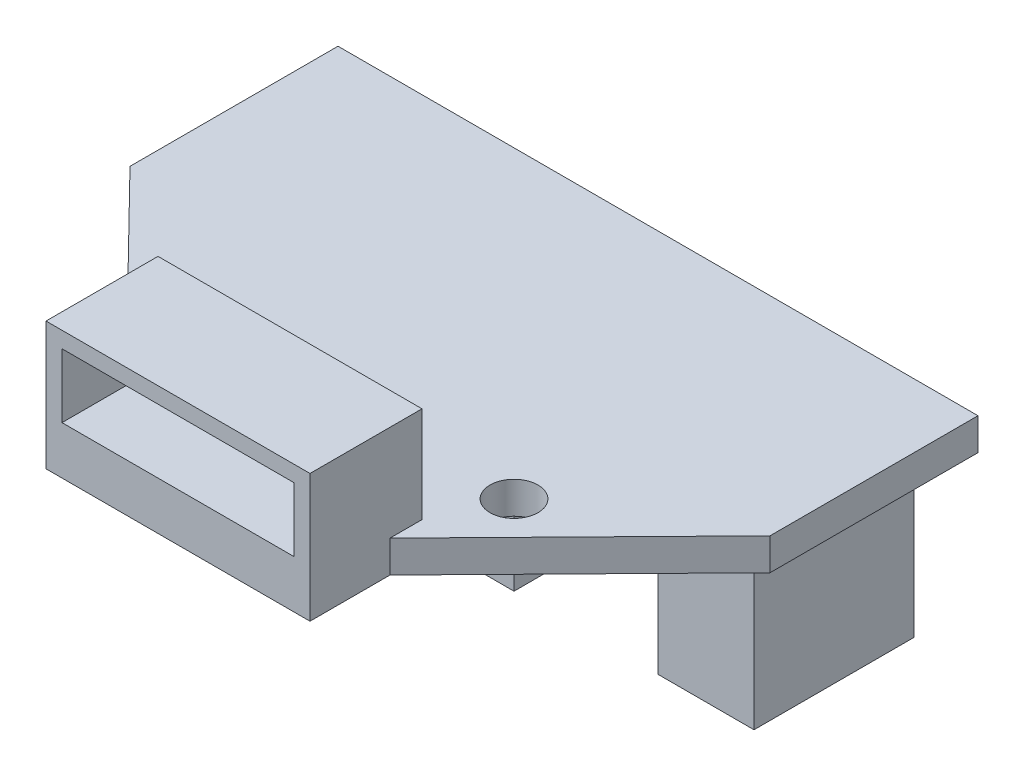
from build123d import *

# Parameters (mm, degrees)
SKETCH_1_R             = 1.5
EXTRUDE_1_DEPTH        = 2
SKETCH_2_W             = 16.5
SKETCH_2_H             = 7
EXTRUDE_2_DEPTH        = 6
SKETCH_3_W             = 6
SKETCH_3_H             = 10
EXTRUDE_3_DEPTH        = 10
PATTERN_LINEAR_1_COUNT = 2
PATTERN_LINEAR_1_PITCH = 15
PATTERN_LINEAR_2_COUNT = 2
PATTERN_LINEAR_2_PITCH = 15
SKETCH_4_W             = 14.5
SKETCH_4_H             = 4
CUT_EXTRUDE_1_DEPTH    = 5


with BuildPart() as part:
    # 草图1 → 凸台-拉伸1 (new body)
    with BuildSketch(Plane(origin=(0, 0, 0), x_dir=(1, 0, 0), z_dir=(0, 1, 0))):
        Polygon((-20, 15), (20, 15), (20, 2), (8.25, -10), (8.25, -15), (-8.25, -15), (-8.25, -10), (-20, 2), align=None)
        with Locations(Location((-10, -4, 0), (0, 0, 270))):
            Circle(SKETCH_1_R, mode=Mode.SUBTRACT)
        with Locations(Location((10, -4, 0), (0, 0, 270))):
            Circle(SKETCH_1_R, mode=Mode.SUBTRACT)
    extrude(amount=EXTRUDE_1_DEPTH)

    # 草图2 → 凸台-拉伸2 (add)
    with BuildSketch(Plane(origin=(0, 2, 0), x_dir=(1, 0, 0), z_dir=(0, 1, 0))):
        with Locations((0, -11.5)):
            Rectangle(SKETCH_2_W, SKETCH_2_H)
    extrude(amount=EXTRUDE_2_DEPTH)

    # 草图3 → 凸台-拉伸3 (add)
    with BuildSketch(Plane.XZ):
        with Locations((0, -8)):
            Rectangle(SKETCH_3_W, SKETCH_3_H)
    extrude_3 = extrude(amount=EXTRUDE_3_DEPTH)

    # 阵列(线性)1: 凸台-拉伸3 ×2
    with Locations(*[(i * PATTERN_LINEAR_1_PITCH, 0, 0) for i in range(1, PATTERN_LINEAR_1_COUNT)]):
        add(extrude_3)

    # 阵列(线性)2: 凸台-拉伸3 ×2
    with Locations(*[(-i * PATTERN_LINEAR_2_PITCH, 0, 0) for i in range(1, PATTERN_LINEAR_2_COUNT)]):
        add(extrude_3)

    # 草图4 → 切除-拉伸1 (cut)
    with BuildSketch(Plane.XY.offset(15)):
        with Locations((0, 5)):
            Rectangle(SKETCH_4_W, SKETCH_4_H)
    extrude(amount=-CUT_EXTRUDE_1_DEPTH, mode=Mode.SUBTRACT)


solid = part.part
